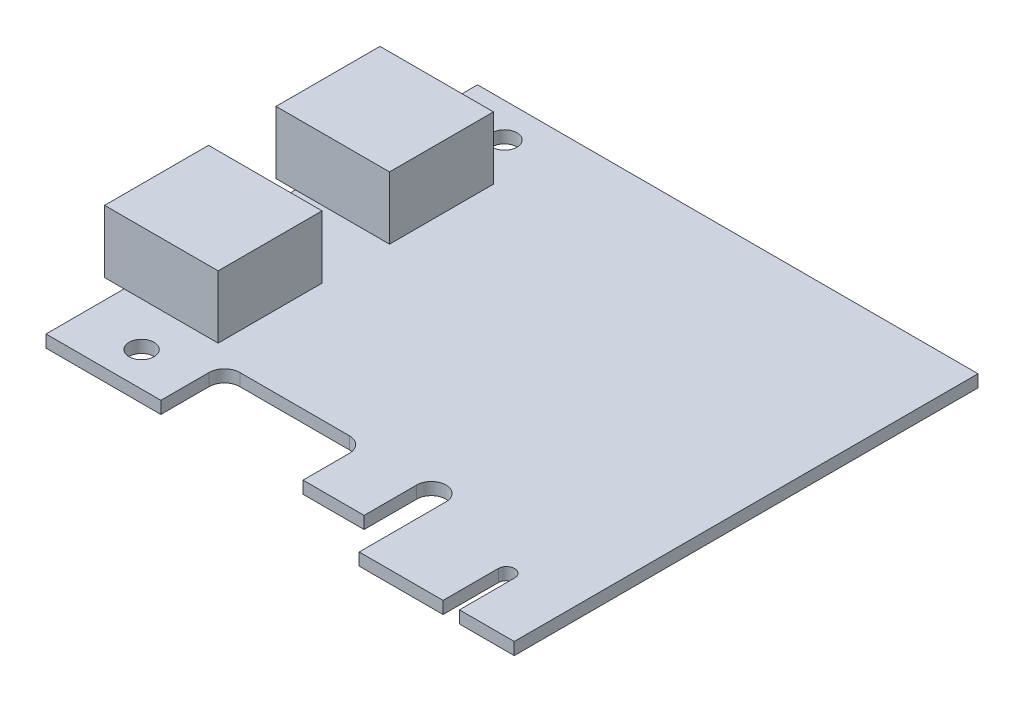
from build123d import *

# Parameters (mm, degrees)
BOSS_EXTRUDE1_DEPTH   = 1.6
F_4_CLEARANCE_HOLE1_D = 3.2639
SKETCH4_W             = 14.7828
SKETCH4_H             = 13.5382
BOSS_EXTRUDE2_DEPTH   = 8.1534


with BuildPart() as part:
    # Sketch1 → Boss-Extrude1 (new body)
    with BuildSketch(Plane(origin=(0, 0, 0), x_dir=(1, 0, 0), z_dir=(0, 1, 0))):
        with BuildLine():
            Line((23.3172, -30.2006), (23.3172, -23.0124))
            ThreePointArc((23.3172, -23.0124), (24.384, -21.9456), (25.4508, -23.0124))
            Line((25.4508, -23.0124), (25.4508, -30.2006))
            Line((25.4508, -30.2006), (32.5882, -30.2006))
            Line((32.5882, -30.2006), (32.5882, 30.2006))
            Line((32.5882, 30.2006), (-32.5882, 30.2006))
            Line((-32.5882, 30.2006), (-32.5882, -26.0096))
            Line((-32.5882, -26.0096), (-17.6276, -26.0096))
            Line((-17.6276, -26.0096), (-17.6276, -19.7292))
            ThreePointArc((-17.6276, -19.7292), (-17.041813562, -18.314986438), (-15.6276, -17.7292))
            Line((-15.6276, -17.7292), (-1.365, -17.7292))
            ThreePointArc((-1.365, -17.7292), (0.049213562, -18.314986438), (0.635, -19.7292))
            Line((0.635, -19.7292), (0.635, -25.7556))
            Line((0.635, -25.7556), (8.5852, -25.7556))
            Line((8.5852, -25.7556), (8.5852, -18.8976))
            ThreePointArc((8.5852, -18.8976), (10.4902, -16.9926), (12.3952, -18.8976))
            Line((12.3952, -18.8976), (12.3952, -30.2006))
            Line((12.3952, -30.2006), (23.3172, -30.2006))
        make_face()
    extrude(amount=BOSS_EXTRUDE1_DEPTH)

    # #4 Clearance Hole1 (through all)
    with Locations(Plane(origin=(0, 1.6, 0), x_dir=(1, 0, 0), z_dir=(0, 1, 0))):
        with Locations((-24.6126, 25.7302), (-24.6126, -21.5392)):
            Hole(F_4_CLEARANCE_HOLE1_D / 2)

    # Sketch4 → Boss-Extrude2 (add)
    with BuildSketch(Plane(origin=(0, 1.6, 0), x_dir=(1, 0, 0), z_dir=(0, 1, 0))):
        with Locations((-27.7368, 13.2588)):
            Rectangle(SKETCH4_W, SKETCH4_H)
        with Locations((-27.7368, -9.0678)):
            Rectangle(SKETCH4_W, SKETCH4_H)
    extrude(amount=BOSS_EXTRUDE2_DEPTH)


solid = part.part
